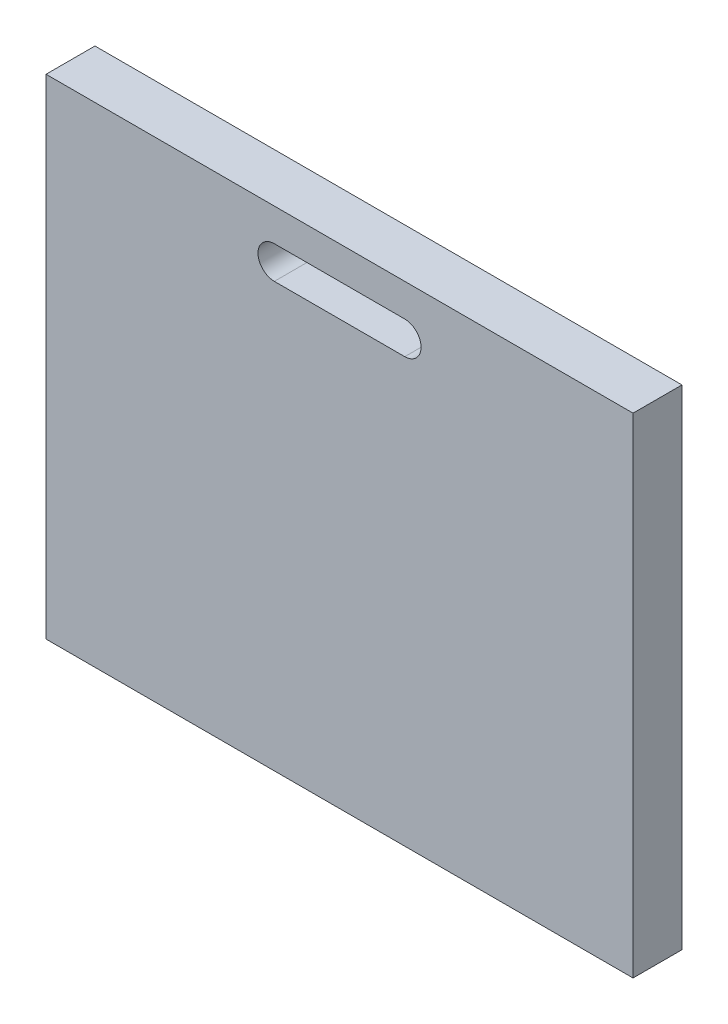
from build123d import *

# Parameters (mm, degrees)
CROQUIS1_W              = 180
CROQUIS1_H              = 150
SALIENTE_EXTRUIR1_DEPTH = 15


with BuildPart() as part:
    # Croquis1 → Saliente-Extruir1 (new body)
    with BuildSketch(Plane.XY):
        with Locations((-63.845623041, -3.714811168)):
            Rectangle(CROQUIS1_W, CROQUIS1_H)
        with BuildLine():
            Line((-83.845623041, 61.285188832), (-43.845623041, 61.285188832))
            ThreePointArc((-43.845623041, 61.285188832), (-38.845623041, 56.285188832), (-43.845623041, 51.285188832))
            Line((-43.845623041, 51.285188832), (-83.845623041, 51.285188832))
            ThreePointArc((-83.845623041, 51.285188832), (-88.845623041, 56.285188832), (-83.845623041, 61.285188832))
        make_face(mode=Mode.SUBTRACT)
    extrude(amount=SALIENTE_EXTRUIR1_DEPTH)


solid = part.part
